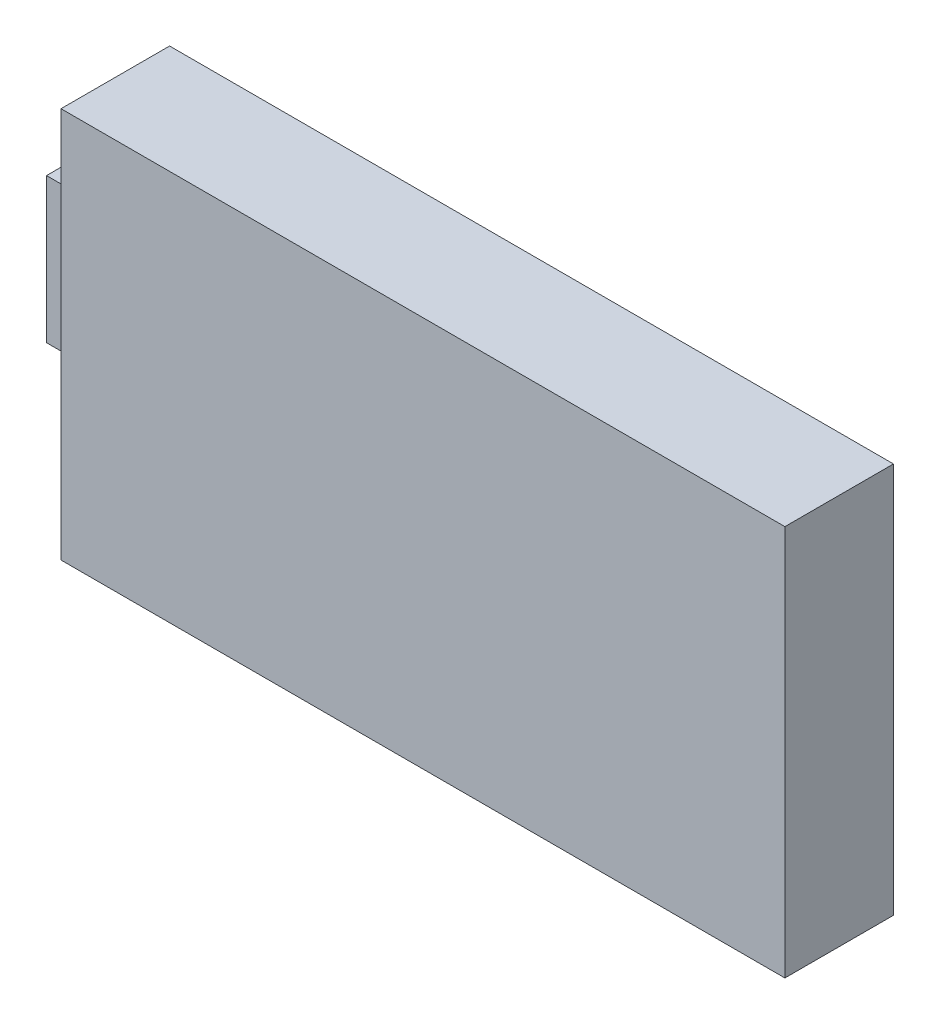
from build123d import *

# Parameters (mm, degrees)
SKETCH1_W           = 50
SKETCH1_H           = 27
BOSS_EXTRUDE1_DEPTH = 7.5
SKETCH2_W           = 3.5
SKETCH2_H           = 10
BOSS_EXTRUDE2_DEPTH = 5


with BuildPart() as part:
    # Sketch1 → Boss-Extrude1 (new body)
    with BuildSketch(Plane.XY):
        Rectangle(SKETCH1_W, SKETCH1_H)
    extrude(amount=BOSS_EXTRUDE1_DEPTH)

    # Sketch2 → Boss-Extrude2 (add)
    with BuildSketch(Plane.ZY.offset(25)):
        with Locations((1.75, 0)):
            Rectangle(SKETCH2_W, SKETCH2_H)
    extrude(amount=BOSS_EXTRUDE2_DEPTH)


solid = part.part
